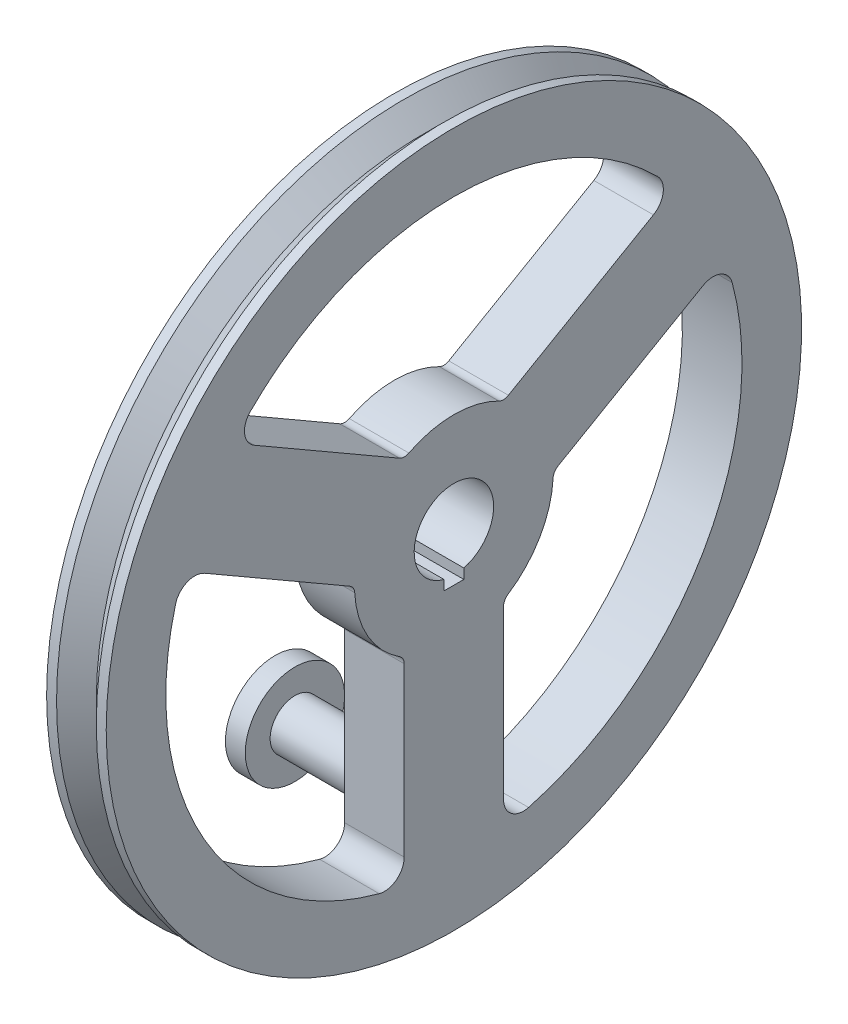
from build123d import *

# Parameters (mm, degrees)
SKETCH1_W           = 30
SKETCH1_H           = 30
BOSS_EXTRUDE1_DEPTH = 15
SKETCH3_R           = 12.5
BOSS_EXTRUDE2_DEPTH = 50
BOSS_EXTRUDE3_START = 50
SKETCH3_3_R         = 25
SKETCH3_3_R_2       = 12.5
BOSS_EXTRUDE3_DEPTH = 10
CUT_EXTRUDE1_DEPTH  = 255.656631565


with BuildPart() as part:
    # Sketch1 → Revolve1 (revolve)
    with BuildSketch(Plane(origin=(0, 0, 0), x_dir=(1, 0, 0), z_dir=(0, 1, 0)), mode=Mode.PRIVATE) as revolve1_sk:
        Polygon((-15, 175), (-15, 145), (15, 145), (15, 175), (10, 175), (0, 165), (-10, 175), align=None)
        with Locations((0, 35)):
            Rectangle(SKETCH1_W, SKETCH1_H)
    revolve(revolve1_sk.sketch.rotate(Axis((0, 0, 0), (1, 0, 0)), 180), axis=Axis((0, 0, 0), (1, 0, 0)))

    # Sketch2 → Boss-Extrude1 (add, symmetric)
    with BuildSketch(Plane(origin=(0, 0, 0), x_dir=(0, 0, -1), z_dir=(1, 0, 0))):
        with BuildLine():
            Line((25, -130.384048104), (25, -46.097722286))
            ThreePointArc((25, -46.097722286), (25.604754635, -43.714065813), (27.272727273, -41.90702026))
            ThreePointArc((27.272727273, -41.90702026), (0, -50), (-27.272727273, -41.90702026))
            ThreePointArc((-27.272727273, -41.90702026), (-25.604754635, -43.714065813), (-25, -46.097722286))
            Line((-25, -46.097722286), (-25, -130.384048104))
            ThreePointArc((-25, -130.384048104), (-28.914193805, -138.31896858), (-37.592592593, -140.042125741))
            ThreePointArc((-37.592592593, -140.042125741), (0, -145), (37.592592593, -140.042125741))
            ThreePointArc((37.592592593, -140.042125741), (28.914193805, -138.31896858), (25, -130.384048104))
        make_face()
        with BuildLine():
            ThreePointArc((-52.421798557, 1.398226049), (-50.659868815, -0.317335065), (-49.928907779, -2.665364518))
            ThreePointArc((-49.928907779, -2.665364518), (-43.301270189, 25), (-22.656180506, 44.572384779))
            ThreePointArc((-22.656180506, 44.572384779), (-25.05511418, 44.031400878), (-27.421798557, 44.699496238))
            Line((-27.421798557, 44.699496238), (-100.415897906, 86.842659147))
            ThreePointArc((-100.415897906, 86.842659147), (-105.330643713, 94.199910656), (-102.483742196, 102.57720305))
            ThreePointArc((-102.483742196, 102.57720305), (-125.573683549, 72.5), (-140.076334788, 37.464922691))
            ThreePointArc((-140.076334788, 37.464922691), (-134.244837518, 44.119057925), (-125.415897906, 43.541388957))
            Line((-125.415897906, 43.541388957), (-52.421798557, 1.398226049))
        make_face()
        with BuildLine():
            ThreePointArc((22.656180506, 44.572384779), (43.301270189, 25), (49.928907779, -2.665364518))
            ThreePointArc((49.928907779, -2.665364518), (50.659868815, -0.317335065), (52.421798557, 1.398226049))
            Line((52.421798557, 1.398226049), (125.415897906, 43.541388957))
            ThreePointArc((125.415897906, 43.541388957), (134.244837518, 44.119057925), (140.076334788, 37.464922691))
            ThreePointArc((140.076334788, 37.464922691), (125.573683549, 72.5), (102.483742196, 102.57720305))
            ThreePointArc((102.483742196, 102.57720305), (105.330643713, 94.199910656), (100.415897906, 86.842659147))
            Line((100.415897906, 86.842659147), (27.421798557, 44.699496238))
            ThreePointArc((27.421798557, 44.699496238), (25.05511418, 44.031400878), (22.656180506, 44.572384779))
        make_face()
    extrude(amount=BOSS_EXTRUDE1_DEPTH, both=True)

    # Sketch3 → Boss-Extrude2 (add)
    with BuildSketch(Plane.ZY.offset(15)):
        with Locations(Location((0, -125, 0), (0, 0, 180))):
            Circle(SKETCH3_R)
    extrude(amount=BOSS_EXTRUDE2_DEPTH)

    # Sketch3<3> → Boss-Extrude3 (add)
    # profile 1 of 2: a face of its own
    with BuildSketch(Plane.ZY.offset(15).offset(BOSS_EXTRUDE3_START)):
        with Locations((0, -125)):
            Circle(SKETCH3_3_R)
        with Locations(Location((0, -125, 0), (0, 0, 180))):
            Circle(SKETCH3_3_R_2, mode=Mode.SUBTRACT)
    # profile 2 of 2: a face of its own
    with BuildSketch(Plane.ZY.offset(15).offset(BOSS_EXTRUDE3_START)):
        with Locations(Location((0, -125, 0), (0, 0, 180))):
            Circle(SKETCH3_3_R_2)
    extrude(amount=BOSS_EXTRUDE3_DEPTH)

    # Sketch4 → Cut-Extrude1 (cut, through all)
    with BuildSketch(Plane.ZY.offset(15)):
        with BuildLine():
            Line((5, -24.364916731), (5, -19.364916731))
            ThreePointArc((5, -19.364916731), (0, -20), (-5, -19.364916731))
            Line((-5, -19.364916731), (-5, -24.364916731))
            Line((-5, -24.364916731), (5, -24.364916731))
        make_face()
    extrude(amount=-CUT_EXTRUDE1_DEPTH, mode=Mode.SUBTRACT)


solid = part.part
